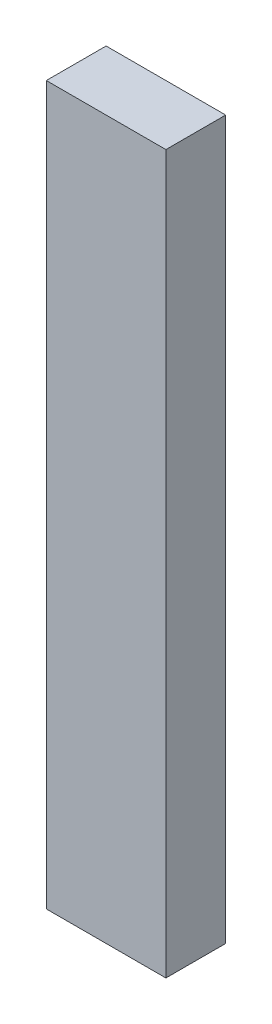
from build123d import *

# Parameters (mm, degrees)
SKETCH1_W           = 101.6
SKETCH1_H           = 50.8
BOSS_EXTRUDE1_DEPTH = 609.6


with BuildPart() as part:
    # Sketch1 → Boss-Extrude1 (new body)
    with BuildSketch(Plane(origin=(0, 0, 0), x_dir=(1, 0, 0), z_dir=(0, 1, 0))):
        with Locations((50.8, -25.4)):
            Rectangle(SKETCH1_W, SKETCH1_H)
    extrude(amount=BOSS_EXTRUDE1_DEPTH)


solid = part.part
